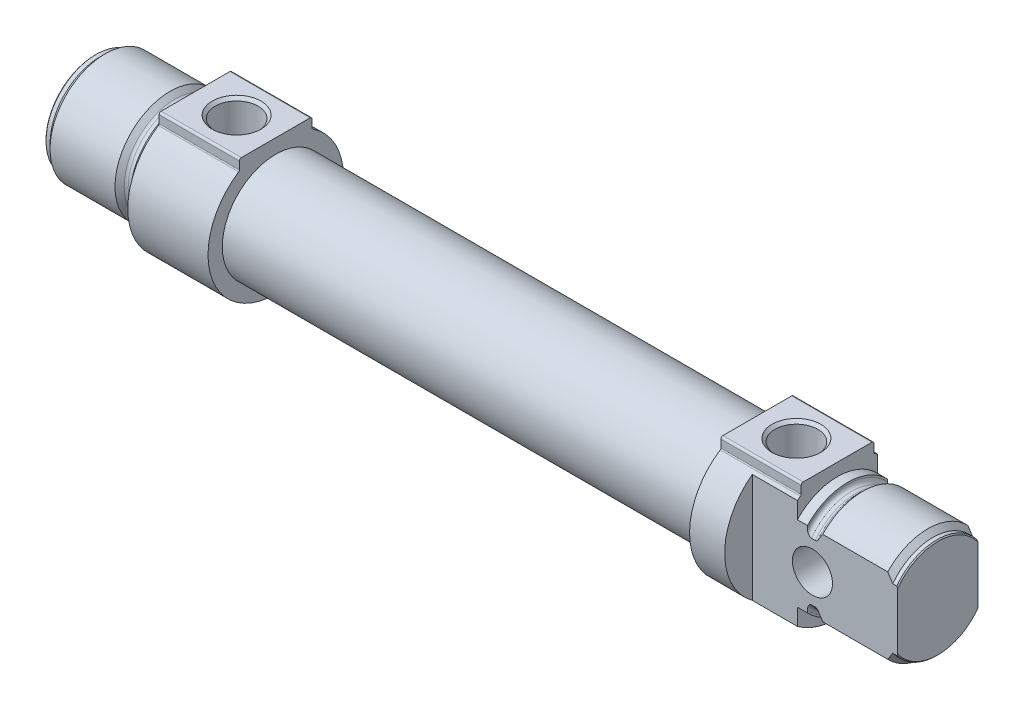
from build123d import *

# Parameters (mm, degrees)
BOSS_EXTRUDE1_DEPTH     = 16
SKETCH3_W               = 96
SKETCH3_H               = 10.65
BOSS_EXTRUDE2_DEPTH     = 16
CUT_EXTRUDE1_DEPTH      = 13.5
CUT_EXTRUDE1_DEPTH_BACK = 13.5
SKETCH7_W               = 16
SKETCH7_H               = 4
HOLE1_D                 = 8.566
HOLE1_DEPTH             = 13.5
HOLE1_CSINK_D           = 9.728
HOLE1_CSINK_ANGLE       = 90
HOLE2_D                 = 8.566
HOLE2_DEPTH             = 16
HOLE2_CSINK_D           = 9.728
HOLE2_CSINK_ANGLE       = 90
HOLE2_TIP               = 2.472791203


with BuildPart() as part:
    # Sketch1 → Revolve1 (revolve)
    with BuildSketch(Plane.XY):
        with BuildLine():
            Line((0, 0), (0, 9.8))
            Line((0, 9.8), (0.2, 10))
            Line((0.2, 10), (1, 10))
            Line((1, 10), (2, 11))
            Line((2, 11), (14.95, 11))
            Line((14.95, 11), (15.865685425, 10.084314575))
            ThreePointArc((15.865685425, 10.084314575), (16.125224104, 9.910896374), (16.43137085, 9.85))
            Line((16.43137085, 9.85), (17.2, 9.85))
            ThreePointArc((17.2, 9.85), (17.765685425, 10.084314575), (18, 10.65))
            Line((18, 10.65), (18, 11))
            Line((18, 11), (20, 11))
            Line((20, 11), (20, 0))
            Line((20, 0), (0, 0))
        make_face()
    revolve(axis=Axis((20, 0, 0), (-1, 0, 0)))

    # Sketch2 → Boss-Extrude1 (add)
    with BuildSketch(Plane(origin=(20, 0, 0), x_dir=(0, 0, -1), z_dir=(1, 0, 0))):
        with BuildLine():
            Line((7.25, 11.551515052), (7.25, 13.1))
            ThreePointArc((7.25, 13.1), (7.132842712, 13.382842712), (6.85, 13.5))
            Line((6.85, 13.5), (-6.85, 13.5))
            ThreePointArc((-6.85, 13.5), (-7.132842712, 13.382842712), (-7.25, 13.1))
            Line((-7.25, 13.1), (-7.25, 11.551515052))
            ThreePointArc((-7.25, 11.551515052), (-7.286144803, 11.408754992), (-7.385869565, 11.30039516))
            ThreePointArc((-7.385869565, 11.30039516), (0, -13.5), (7.385869565, 11.30039516))
            ThreePointArc((7.385869565, 11.30039516), (7.286144803, 11.408754992), (7.25, 11.551515052))
        make_face()
    extrude(amount=BOSS_EXTRUDE1_DEPTH)

    # Sketch3 → Revolve2 (revolve)
    with BuildSketch(Plane.XY):
        with Locations((84, 5.325)):
            Rectangle(SKETCH3_W, SKETCH3_H)
    revolve(axis=Axis((132, 0, 0), (-1, 0, 0)))

    # Sketch4 → Boss-Extrude2 (add)
    with BuildSketch(Plane(origin=(132, 0, 0), x_dir=(0, 0, -1), z_dir=(1, 0, 0))):
        with BuildLine():
            Line((7.25, 11.551515052), (7.25, 13.1))
            ThreePointArc((7.25, 13.1), (7.132842712, 13.382842712), (6.85, 13.5))
            Line((6.85, 13.5), (-6.85, 13.5))
            ThreePointArc((-6.85, 13.5), (-7.132842712, 13.382842712), (-7.25, 13.1))
            Line((-7.25, 13.1), (-7.25, 11.551515052))
            ThreePointArc((-7.25, 11.551515052), (-7.286144803, 11.408754992), (-7.385869565, 11.30039516))
            ThreePointArc((-7.385869565, 11.30039516), (0, -13.5), (7.385869565, 11.30039516))
            ThreePointArc((7.385869565, 11.30039516), (7.286144803, 11.408754992), (7.25, 11.551515052))
        make_face()
    extrude(amount=BOSS_EXTRUDE2_DEPTH)

    # Sketch5 → Revolve3 (revolve)
    with BuildSketch(Plane.XY):
        with BuildLine():
            Line((148, 0), (148, 11))
            Line((148, 11), (150, 11))
            Line((150, 11), (150, 10.65))
            ThreePointArc((150, 10.65), (150.234314575, 10.084314575), (150.8, 9.85))
            Line((150.8, 9.85), (151.56862915, 9.85))
            ThreePointArc((151.56862915, 9.85), (151.874775896, 9.910896374), (152.134314575, 10.084314575))
            Line((152.134314575, 10.084314575), (153.05, 11))
            Line((153.05, 11), (166, 11))
            Line((166, 11), (167, 10))
            Line((167, 10), (167.8, 10))
            Line((167.8, 10), (168, 9.8))
            Line((168, 9.8), (168, 0))
            Line((168, 0), (148, 0))
        make_face()
    revolve(axis=Axis((168, 0, 0), (-1, 0, 0)))

    # Sketch6 → Cut-Extrude1 (cut, two sides: drawn at the far end of the back side and taken through both)
    with BuildSketch(Plane(origin=(0, 0, 0), x_dir=(1, 0, 0), z_dir=(0, 1, 0)).offset(-CUT_EXTRUDE1_DEPTH_BACK)):
        Polygon((139, 24), (139, 8), (168, 8), (168, -8), (139, -8), (139, -24), (184, -24), (184, 24), align=None)
    extrude(amount=CUT_EXTRUDE1_DEPTH + CUT_EXTRUDE1_DEPTH_BACK, mode=Mode.SUBTRACT)

    # Sketch7 → Cut-Revolve1 (revolve, cut)
    with BuildSketch(Plane(origin=(151, 0, 0), x_dir=(0, 0, -1), z_dir=(1, 0, 0))):
        with Locations((0, 2)):
            Rectangle(SKETCH7_W, SKETCH7_H)
    revolve(axis=Axis((151, 0, -8), (0, 0, 1)), mode=Mode.SUBTRACT)

    # Hole1
    with Locations(Plane(origin=(0, 13.5, 0), x_dir=(1, 0, 0), z_dir=(0, 1, 0))):
        with Locations((28.2, 0)):
            CounterSinkHole(HOLE1_D / 2, HOLE1_CSINK_D / 2, depth=HOLE1_DEPTH, counter_sink_angle=HOLE1_CSINK_ANGLE)

    # Hole2
    with Locations(Plane(origin=(0, 13.5, 0), x_dir=(1, 0, 0), z_dir=(0, 1, 0))):
        with Locations((139.8, 0)):
            CounterSinkHole(HOLE2_D / 2, HOLE2_CSINK_D / 2, depth=HOLE2_DEPTH, counter_sink_angle=HOLE2_CSINK_ANGLE)
            with Locations((0, 0, -(HOLE2_DEPTH + HOLE2_TIP / 2))):  # 120° drill point
                Cone(0, HOLE2_D / 2, HOLE2_TIP, mode=Mode.SUBTRACT)

    # Sketch12 → Cut-Revolve2 (revolve, cut)
    with BuildSketch(Plane.XY):
        Polygon((-4, 0), (-4, 4), (50.3, 4), (50.3, 10), (115.3, 10), (115.3, 0), align=None)
    revolve(axis=Axis((115.3, 0, 0), (-1, 0, 0)), mode=Mode.SUBTRACT)


solid = part.part
